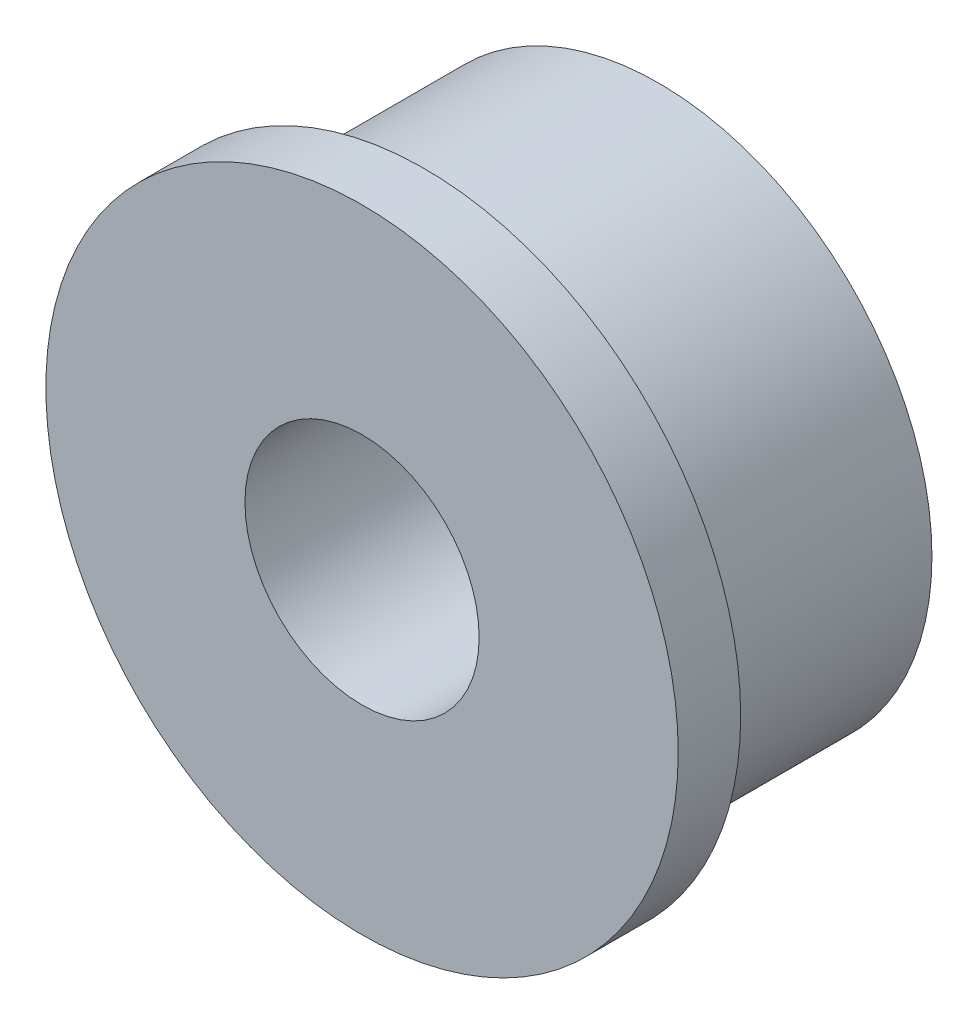
from build123d import *

# Parameters (mm, degrees)
SKETCH_1_R      = 3.5
SKETCH_1_R_2    = 1.5
EXTRUDE_1_DEPTH = 3
SKETCH_2_R      = 4.05
SKETCH_2_R_2    = 1.5
EXTRUDE_2_DEPTH = 0.8


with BuildPart() as part:
    # 草图1 → 凸台-拉伸1 (new body)
    with BuildSketch(Plane.XY):
        Circle(SKETCH_1_R)
        Circle(SKETCH_1_R_2, mode=Mode.SUBTRACT)
    extrude(amount=EXTRUDE_1_DEPTH)

    # 草图2 → 凸台-拉伸2 (add)
    with BuildSketch(Plane.XY.offset(3)):
        Circle(SKETCH_2_R)
        Circle(SKETCH_2_R_2, mode=Mode.SUBTRACT)
    extrude(amount=EXTRUDE_2_DEPTH)


solid = part.part
